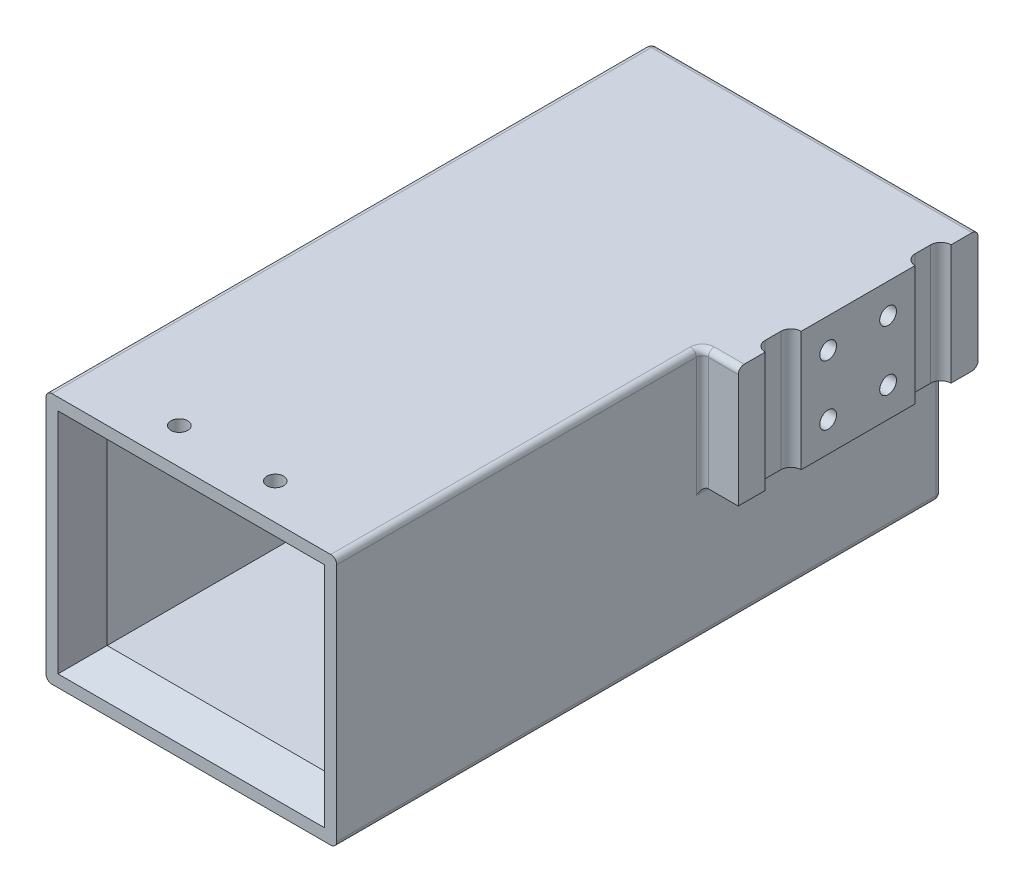
from build123d import *

# Parameters (mm, degrees)
SKETCH2_W                         = 48.5
SKETCH2_H                         = 42
SKETCH2_W_2                       = 38.5
SKETCH2_H_2                       = 32
SLEEVE_DEPTH                      = 97
SKETCH3_W                         = 48.5
SKETCH3_H                         = 42
REAR_COVER_DEPTH                  = 4
BASKET_CLAMP_DEPTH                = 20
SKETCH5_R                         = 1.4
BASKET_CLAMP_MOUNTING_HOLES_DEPTH = 7
SKETCH7_R                         = 1.4
FRONT_COVER_SCREW_HOLES_TOP_DEPTH = 4
F_1MM_EDGE_FILLETS_R              = 1
BATTERY_INSERTION_CHAMFER_SIZE    = 3
BATTERY_INSERTION_CHAMFER_SIZE2   = 5.196152423


with BuildPart() as part:
    # Sketch2 → Sleeve (new body)
    with BuildSketch(Plane.XY):
        Rectangle(SKETCH2_W, SKETCH2_H)
        Rectangle(SKETCH2_W_2, SKETCH2_H_2, mode=Mode.SUBTRACT)
    extrude(amount=SLEEVE_DEPTH)

    # Sketch3 → Rear Cover (add)
    with BuildSketch(Plane(origin=(0, 0, 0), x_dir=(-1, 0, 0), z_dir=(0, 0, -1))):
        Rectangle(SKETCH3_W, SKETCH3_H)
    extrude(amount=REAR_COVER_DEPTH)

    # Sketch4 → Basket Clamp (add)
    with BuildSketch(Plane(origin=(0, 21, 0), x_dir=(1, 0, 0), z_dir=(0, 1, 0))):
        with BuildLine():
            Line((24.25, 4), (24.25, -36))
            Line((24.25, -36), (30.25, -36))
            Line((30.25, -36), (30.25, -31.5))
            ThreePointArc((30.25, -31.5), (29.047918472, -31.002081528), (28.55, -29.8))
            Line((28.55, -29.8), (28.55, -27.2))
            ThreePointArc((28.55, -27.2), (29.047918472, -25.997918472), (30.25, -25.5))
            Line((30.25, -25.5), (30.25, -6.5))
            ThreePointArc((30.25, -6.5), (29.047918472, -6.002081528), (28.55, -4.8))
            Line((28.55, -4.8), (28.55, -2.2))
            ThreePointArc((28.55, -2.2), (29.047918472, -0.997918472), (30.25, -0.5))
            Line((30.25, -0.5), (30.25, 4))
            Line((30.25, 4), (24.25, 4))
        make_face()
    extrude(amount=-BASKET_CLAMP_DEPTH)

    # Sketch5 → Basket Clamp Mounting Holes (cut)
    with BuildSketch(Plane(origin=(30.25, 0, 0), x_dir=(0, 0, -1), z_dir=(1, 0, 0))):
        with Locations((-21, 16)):
            Circle(SKETCH5_R)
        with Locations((-11, 16)):
            Circle(SKETCH5_R)
        with Locations((-11, 6)):
            Circle(SKETCH5_R)
        with Locations((-21, 6)):
            Circle(SKETCH5_R)
    extrude(amount=-BASKET_CLAMP_MOUNTING_HOLES_DEPTH, mode=Mode.SUBTRACT)

    # Sketch7 → Front Cover Screw Holes Top (cut)
    with BuildSketch(Plane(origin=(0, 21, 0), x_dir=(1, 0, 0), z_dir=(0, 1, 0))):
        with Locations((-8, -91)):
            Circle(SKETCH7_R)
        with Locations((8, -91)):
            Circle(SKETCH7_R)
    front_cover_screw_holes_top = extrude(amount=-FRONT_COVER_SCREW_HOLES_TOP_DEPTH, mode=Mode.SUBTRACT)

    # Front Cover Screw Holes Bottom: Front Cover Screw Holes Top across plane
    add(front_cover_screw_holes_top.mirror(Plane.ZX), mode=Mode.SUBTRACT)

    # 1mm Edge Fillets
    f_1mm_edge_fillets_edges = [part.edges().sort_by_distance(p)[0] for p in [
        (27.25, 1, -4),
        (-24.25, -21, 46.5),
        (24.25, 11, 36),
        (24.25, 1, 16),
        (24.25, -21, 46.5),
        (0, -21, -4),
        (24.25, -10, -4),
        (-24.25, 0, -4),
        (3, 21, -4),
        (-24.25, 21, 46.5),
        (24.25, 21, 66.5),
        (27.25, 21, 36),
    ]]
    fillet(f_1mm_edge_fillets_edges, radius=F_1MM_EDGE_FILLETS_R)

    # Battery Insertion Chamfer
    battery_insertion_chamfer_edges = [part.edges().sort_by_distance(p)[0] for p in [
        (19.25, 0, 97),
        (0, 16, 97),
        (-19.25, 0, 97),
        (0, -16, 97),
    ]]
    battery_insertion_chamfer_side = [part.faces().sort_by_distance(p)[0] for p in [
        (0, 20.358419919, 97),
    ]]
    chamfer(battery_insertion_chamfer_edges, length=BATTERY_INSERTION_CHAMFER_SIZE, length2=BATTERY_INSERTION_CHAMFER_SIZE2, reference=battery_insertion_chamfer_side[0])


solid = part.part
